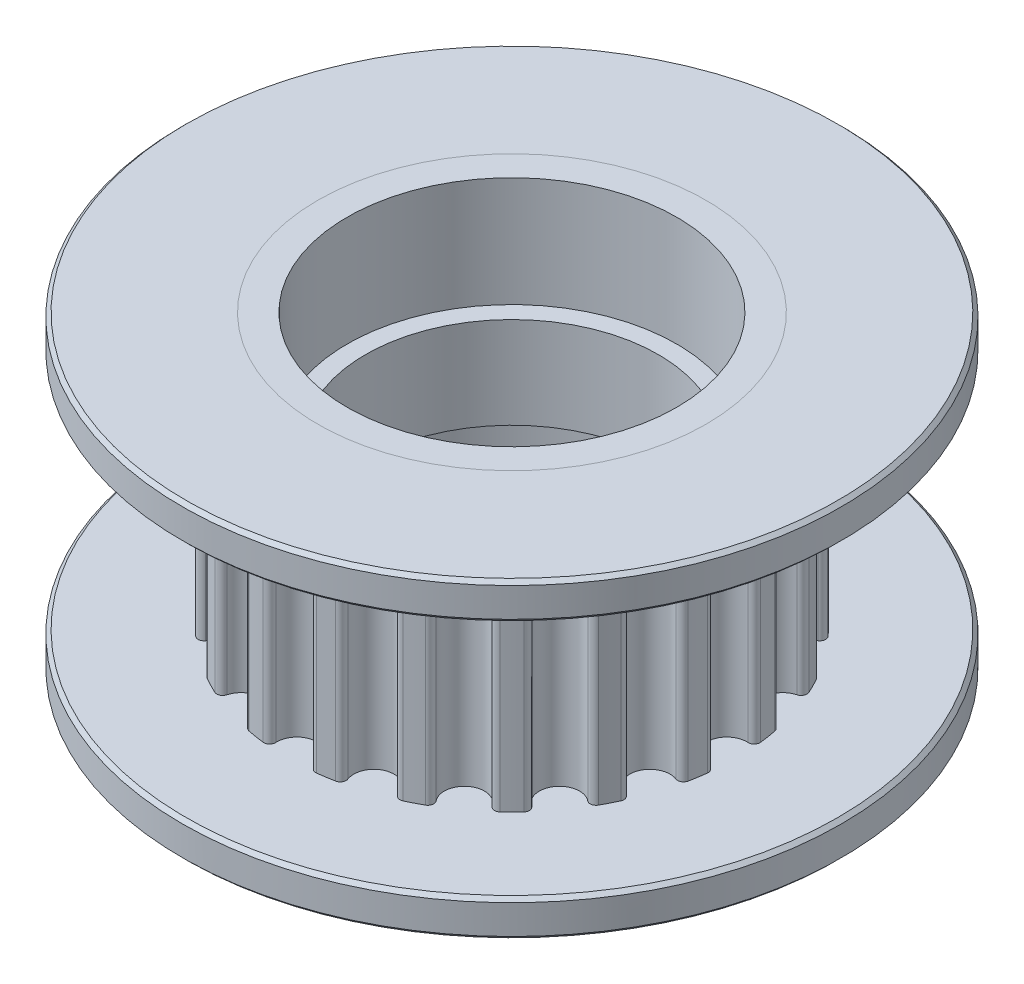
from build123d import *

# Parameters (mm, degrees)
ODEBRAT_START            = -6.5
SKICA2_R                 = 9
ODEBRAT_VYSUNUT_M1_DEPTH = 6.5
SKICA3_R                 = 9
SKICA3_R_2               = 5.3
P_IDAT_VYSUNUT_M1_DEPTH  = 1
SKICA5_R                 = 9
SKICA5_R_2               = 5.3
P_IDAT_VYSUNUT_M2_DEPTH  = 1
ZKOSEN_1_SIZE            = 0.1
ZKOSEN_2_SIZE            = 0.1


with BuildPart() as part:
    # Skica1 → Rotovat1 (revolve)
    with BuildSketch(Plane.XY):
        Polygon((4.5, 8.5), (5.3, 8.5), (5.3, 7.5), (9, 7.5), (9, 1), (5.3, 1), (5.3, 0), (4.5, 0), (4.5, 3), (4, 3), (4, 5.5), (4.5, 5.5), align=None)
    revolve(axis=Axis((0, 0, 0), (0, 1, 0)))

    # Skica2 → Odebrat vysunutím1 (cut)
    with BuildSketch(Plane(origin=(0, 7.5, 0), x_dir=(1, 0, 0), z_dir=(0, 1, 0)).offset(ODEBRAT_START)):
        Circle(SKICA2_R)
        with BuildLine():
            ThreePointArc((-0.549227949, 5.899131775), (0, 5.32), (0.549227949, 5.899131775))
            ThreePointArc((0.549227949, 5.899131775), (0.599687134, 6.024439536), (0.728068988, 6.06646648))
            ThreePointArc((0.728068988, 6.06646648), (0.955814581, 6.034775761), (1.182206482, 5.994538167))
            ThreePointArc((1.182206482, 5.994538167), (1.291317841, 5.914895994), (1.300585151, 5.780128485))
            ThreePointArc((1.300585151, 5.780128485), (1.64397041, 5.059620667), (2.34527879, 5.440686945))
            ThreePointArc((2.34527879, 5.440686945), (2.431990555, 5.544268962), (2.567075994, 5.544566786))
            ThreePointArc((2.567075994, 5.544566786), (2.773881953, 5.444049863), (2.976759346, 5.335822692))
            ThreePointArc((2.976759346, 5.335822692), (3.05591963, 5.22636122), (3.023087915, 5.095325947))
            ThreePointArc((3.023087915, 5.095325947), (3.127017542, 4.30397041), (3.911757403, 4.44966977))
            ThreePointArc((3.911757403, 4.44966977), (4.026233796, 4.521386713), (4.154799715, 4.479926264))
            ThreePointArc((4.154799715, 4.479926264), (4.320422433, 4.320422433), (4.479926264, 4.154799715))
            ThreePointArc((4.479926264, 4.154799715), (4.521386713, 4.026233796), (4.44966977, 3.911757403))
            ThreePointArc((4.44966977, 3.911757403), (4.30397041, 3.127017542), (5.095325947, 3.023087915))
            ThreePointArc((5.095325947, 3.023087915), (5.22636122, 3.05591963), (5.335822692, 2.976759346))
            ThreePointArc((5.335822692, 2.976759346), (5.444049863, 2.773881953), (5.544566786, 2.567075994))
            ThreePointArc((5.544566786, 2.567075994), (5.544268962, 2.431990555), (5.440686945, 2.34527879))
            ThreePointArc((5.440686945, 2.34527879), (5.059620667, 1.64397041), (5.780128485, 1.300585151))
            ThreePointArc((5.780128485, 1.300585151), (5.914895994, 1.291317841), (5.994538167, 1.182206482))
            ThreePointArc((5.994538167, 1.182206482), (6.034775761, 0.955814581), (6.06646648, 0.728068988))
            ThreePointArc((6.06646648, 0.728068988), (6.024439536, 0.599687134), (5.899131775, 0.549227949))
            ThreePointArc((5.899131775, 0.549227949), (5.32, 0), (5.899131775, -0.549227949))
            ThreePointArc((5.899131775, -0.549227949), (6.024439536, -0.599687134), (6.06646648, -0.728068988))
            ThreePointArc((6.06646648, -0.728068988), (6.034775761, -0.955814581), (5.994538167, -1.182206482))
            ThreePointArc((5.994538167, -1.182206482), (5.914895994, -1.291317841), (5.780128485, -1.300585151))
            ThreePointArc((5.780128485, -1.300585151), (5.059620667, -1.64397041), (5.440686945, -2.34527879))
            ThreePointArc((5.440686945, -2.34527879), (5.544268962, -2.431990555), (5.544566786, -2.567075994))
            ThreePointArc((5.544566786, -2.567075994), (5.444049863, -2.773881953), (5.335822692, -2.976759346))
            ThreePointArc((5.335822692, -2.976759346), (5.22636122, -3.05591963), (5.095325947, -3.023087915))
            ThreePointArc((5.095325947, -3.023087915), (4.30397041, -3.127017542), (4.44966977, -3.911757403))
            ThreePointArc((4.44966977, -3.911757403), (4.521386713, -4.026233796), (4.479926264, -4.154799715))
            ThreePointArc((4.479926264, -4.154799715), (4.320422433, -4.320422433), (4.154799715, -4.479926264))
            ThreePointArc((4.154799715, -4.479926264), (4.026233796, -4.521386713), (3.911757403, -4.44966977))
            ThreePointArc((3.911757403, -4.44966977), (3.127017542, -4.30397041), (3.023087915, -5.095325947))
            ThreePointArc((3.023087915, -5.095325947), (3.05591963, -5.22636122), (2.976759346, -5.335822692))
            ThreePointArc((2.976759346, -5.335822692), (2.773881953, -5.444049863), (2.567075994, -5.544566786))
            ThreePointArc((2.567075994, -5.544566786), (2.431990555, -5.544268962), (2.34527879, -5.440686945))
            ThreePointArc((2.34527879, -5.440686945), (1.64397041, -5.059620667), (1.300585151, -5.780128485))
            ThreePointArc((1.300585151, -5.780128485), (1.291317841, -5.914895994), (1.182206482, -5.994538167))
            ThreePointArc((1.182206482, -5.994538167), (0.955814581, -6.034775761), (0.728068988, -6.06646648))
            ThreePointArc((0.728068988, -6.06646648), (0.599687134, -6.024439536), (0.549227949, -5.899131775))
            ThreePointArc((0.549227949, -5.899131775), (0, -5.32), (-0.549227949, -5.899131775))
            ThreePointArc((-0.549227949, -5.899131775), (-0.599687134, -6.024439536), (-0.728068988, -6.06646648))
            ThreePointArc((-0.728068988, -6.06646648), (-0.955814581, -6.034775761), (-1.182206482, -5.994538167))
            ThreePointArc((-1.182206482, -5.994538167), (-1.291317841, -5.914895994), (-1.300585151, -5.780128485))
            ThreePointArc((-1.300585151, -5.780128485), (-1.64397041, -5.059620667), (-2.34527879, -5.440686945))
            ThreePointArc((-2.34527879, -5.440686945), (-2.431990555, -5.544268962), (-2.567075994, -5.544566786))
            ThreePointArc((-2.567075994, -5.544566786), (-2.773881953, -5.444049863), (-2.976759346, -5.335822692))
            ThreePointArc((-2.976759346, -5.335822692), (-3.05591963, -5.22636122), (-3.023087915, -5.095325947))
            ThreePointArc((-3.023087915, -5.095325947), (-3.127017542, -4.30397041), (-3.911757403, -4.44966977))
            ThreePointArc((-3.911757403, -4.44966977), (-4.026233796, -4.521386713), (-4.154799715, -4.479926264))
            ThreePointArc((-4.154799715, -4.479926264), (-4.320422433, -4.320422433), (-4.479926264, -4.154799715))
            ThreePointArc((-4.479926264, -4.154799715), (-4.521386713, -4.026233796), (-4.44966977, -3.911757403))
            ThreePointArc((-4.44966977, -3.911757403), (-4.30397041, -3.127017542), (-5.095325947, -3.023087915))
            ThreePointArc((-5.095325947, -3.023087915), (-5.22636122, -3.05591963), (-5.335822692, -2.976759346))
            ThreePointArc((-5.335822692, -2.976759346), (-5.444049863, -2.773881953), (-5.544566786, -2.567075994))
            ThreePointArc((-5.544566786, -2.567075994), (-5.544268962, -2.431990555), (-5.440686945, -2.34527879))
            ThreePointArc((-5.440686945, -2.34527879), (-5.059620667, -1.64397041), (-5.780128485, -1.300585151))
            ThreePointArc((-5.780128485, -1.300585151), (-5.914895994, -1.291317841), (-5.994538167, -1.182206482))
            ThreePointArc((-5.994538167, -1.182206482), (-6.034775761, -0.955814581), (-6.06646648, -0.728068988))
            ThreePointArc((-6.06646648, -0.728068988), (-6.024439536, -0.599687134), (-5.899131775, -0.549227949))
            ThreePointArc((-5.899131775, -0.549227949), (-5.32, 0), (-5.899131775, 0.549227949))
            ThreePointArc((-5.899131775, 0.549227949), (-6.024439536, 0.599687134), (-6.06646648, 0.728068988))
            ThreePointArc((-6.06646648, 0.728068988), (-6.034775761, 0.955814581), (-5.994538167, 1.182206482))
            ThreePointArc((-5.994538167, 1.182206482), (-5.914895994, 1.291317841), (-5.780128485, 1.300585151))
            ThreePointArc((-5.780128485, 1.300585151), (-5.059620667, 1.64397041), (-5.440686945, 2.34527879))
            ThreePointArc((-5.440686945, 2.34527879), (-5.544268962, 2.431990555), (-5.544566786, 2.567075994))
            ThreePointArc((-5.544566786, 2.567075994), (-5.444049863, 2.773881953), (-5.335822692, 2.976759346))
            ThreePointArc((-5.335822692, 2.976759346), (-5.22636122, 3.05591963), (-5.095325947, 3.023087915))
            ThreePointArc((-5.095325947, 3.023087915), (-4.30397041, 3.127017542), (-4.44966977, 3.911757403))
            ThreePointArc((-4.44966977, 3.911757403), (-4.521386713, 4.026233796), (-4.479926264, 4.154799715))
            ThreePointArc((-4.479926264, 4.154799715), (-4.320422433, 4.320422433), (-4.154799715, 4.479926264))
            ThreePointArc((-4.154799715, 4.479926264), (-4.026233796, 4.521386713), (-3.911757403, 4.44966977))
            ThreePointArc((-3.911757403, 4.44966977), (-3.127017542, 4.30397041), (-3.023087915, 5.095325947))
            ThreePointArc((-3.023087915, 5.095325947), (-3.05591963, 5.22636122), (-2.976759346, 5.335822692))
            ThreePointArc((-2.976759346, 5.335822692), (-2.773881953, 5.444049863), (-2.567075994, 5.544566786))
            ThreePointArc((-2.567075994, 5.544566786), (-2.431990555, 5.544268962), (-2.34527879, 5.440686945))
            ThreePointArc((-2.34527879, 5.440686945), (-1.64397041, 5.059620667), (-1.300585151, 5.780128485))
            ThreePointArc((-1.300585151, 5.780128485), (-1.291317841, 5.914895994), (-1.182206482, 5.994538167))
            ThreePointArc((-1.182206482, 5.994538167), (-0.955814581, 6.034775761), (-0.728068988, 6.06646648))
            ThreePointArc((-0.728068988, 6.06646648), (-0.599687134, 6.024439536), (-0.549227949, 5.899131775))
        make_face(mode=Mode.SUBTRACT)
    extrude(amount=ODEBRAT_VYSUNUT_M1_DEPTH, mode=Mode.SUBTRACT)


with BuildPart() as body_2:
    # Skica3 → Přidat vysunutím1 (new body)
    with BuildSketch(Plane(origin=(0, 7.5, 0), x_dir=(1, 0, 0), z_dir=(0, 1, 0))):
        with Locations(Location((0, 0, 0), (0, 0, 180))):
            Circle(SKICA3_R)
        with Locations(Location((0, 0, 0), (0, 0, 180))):
            Circle(SKICA3_R_2, mode=Mode.SUBTRACT)
    extrude(amount=P_IDAT_VYSUNUT_M1_DEPTH)

    # Zkosení1
    zkosen_1_edges = [body_2.edges().sort_by_distance(p)[0] for p in [
        (9, 7.5, 0),
        (9, 8.5, 0),
    ]]
    chamfer(zkosen_1_edges, length=ZKOSEN_1_SIZE)


with BuildPart() as body_3:
    # Skica5 → Přidat vysunutím2 (new body)
    with BuildSketch(Plane.XZ.offset(-1)):
        Circle(SKICA5_R)
        Circle(SKICA5_R_2, mode=Mode.SUBTRACT)
    extrude(amount=P_IDAT_VYSUNUT_M2_DEPTH)

    # Zkosení2
    zkosen_2_edges = [body_3.edges().sort_by_distance(p)[0] for p in [
        (-9, 1, 0),
        (-9, 0, 0),
    ]]
    chamfer(zkosen_2_edges, length=ZKOSEN_2_SIZE)


solid = Compound([part.part, body_2.part, body_3.part])
